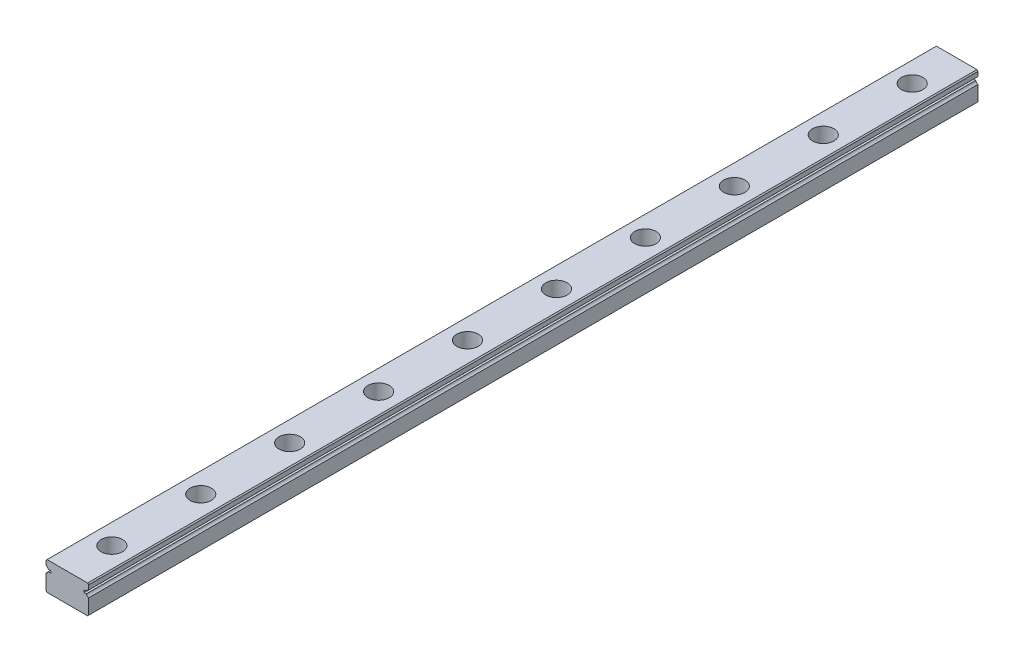
from build123d import *

# Parameters (mm, degrees)
EXTRUDE_1_DEPTH        = 250
SKETCH_2_R             = 3
SKETCH_2_R_2           = 1.75
CUT_EXTRUDE_1_DEPTH    = 4.5
SKETCH_2_2_R           = 1.75
CUT_EXTRUDE_2_DEPTH    = 251.199920064
PATTERN_LINEAR_1_COUNT = 10
PATTERN_LINEAR_1_PITCH = 25


with BuildPart() as part:
    # Эскиз1 → Бобышка-Вытянуть1 (new body)
    with BuildSketch(Plane.XY):
        with BuildLine():
            Line((-6, 3.7), (-5.7, 4))
            Line((-5.7, 4), (5.7, 4))
            Line((5.7, 4), (6, 3.7))
            Line((6, 3.7), (6, 2.451013544))
            ThreePointArc((6, 2.451013544), (5.597935912, 2.202976267), (5.354599002, 1.798050138))
            Line((5.354599002, 1.798050138), (4.643514056, 1.798050138))
            Line((4.643514056, 1.798050138), (4.643514056, 1.201949862))
            Line((4.643514056, 1.201949862), (5.354599002, 1.201949862))
            ThreePointArc((5.354599002, 1.201949862), (5.597935912, 0.797023733), (6, 0.548986456))
            Line((6, 0.548986456), (6, -3.7))
            Line((6, -3.7), (5.7, -4))
            Line((5.7, -4), (-5.7, -4))
            Line((-5.7, -4), (-6, -3.7))
            Line((-6, -3.7), (-6, 0.548986456))
            ThreePointArc((-6, 0.548986456), (-5.597935912, 0.797023733), (-5.354599002, 1.201949862))
            Line((-5.354599002, 1.201949862), (-4.643514056, 1.201949862))
            Line((-4.643514056, 1.201949862), (-4.643514056, 1.798050138))
            Line((-4.643514056, 1.798050138), (-5.354599002, 1.798050138))
            ThreePointArc((-5.354599002, 1.798050138), (-5.597935912, 2.202976267), (-6, 2.451013544))
            Line((-6, 2.451013544), (-6, 3.7))
        make_face()
    extrude(amount=EXTRUDE_1_DEPTH)

    # Эскиз2 → Вырез-Вытянуть1 (cut)
    with BuildSketch(Plane(origin=(0, 4, 0), x_dir=(1, 0, 0), z_dir=(0, 1, 0))):
        with Locations(Location((0, -12.5, 0), (0, 0, 270))):
            Circle(SKETCH_2_R)
        with Locations(Location((0, -12.5, 0), (0, 0, 270))):
            Circle(SKETCH_2_R_2, mode=Mode.SUBTRACT)
    cut_extrude_1 = extrude(amount=-CUT_EXTRUDE_1_DEPTH, mode=Mode.SUBTRACT)

    # Эскиз2<2> → Вырез-Вытянуть2 (cut, through all)
    with BuildSketch(Plane(origin=(0, 4, 0), x_dir=(1, 0, 0), z_dir=(0, 1, 0))):
        with Locations(Location((0, -12.5, 0), (0, 0, 270))):
            Circle(SKETCH_2_2_R)
    cut_extrude_2 = extrude(amount=-CUT_EXTRUDE_2_DEPTH, mode=Mode.SUBTRACT)

    # Линейный массив1: Вырез-Вытянуть1, Вырез-Вытянуть2 ×10
    with Locations(*[(0, 0, i * PATTERN_LINEAR_1_PITCH) for i in range(1, PATTERN_LINEAR_1_COUNT)]):
        add(cut_extrude_1, mode=Mode.SUBTRACT)
        add(cut_extrude_2, mode=Mode.SUBTRACT)


solid = part.part
